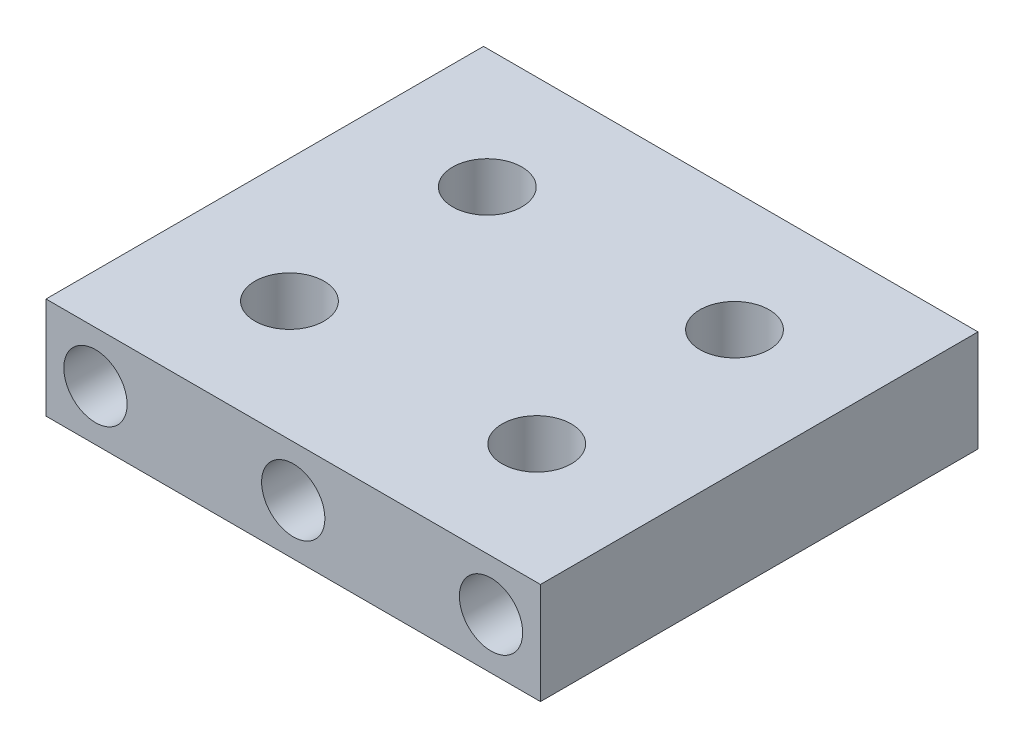
from build123d import *

# Parameters (mm, degrees)
SKETCH1_W           = 25
SKETCH1_H           = 22.12
SKETCH1_R           = 1.75
BOSS_EXTRUDE1_DEPTH = 5.13
CUT_EXTRUDE1_REACH  = 27.92
SKETCH2_R           = 1.6


with BuildPart() as part:
    # Sketch1 → Boss-Extrude1 (new body)
    with BuildSketch(Plane(origin=(0, 0, 0), x_dir=(1, 0, 0), z_dir=(0, 1, 0))):
        Rectangle(SKETCH1_W, SKETCH1_H)
        with Locations((-6.25, -5)):
            Circle(SKETCH1_R, mode=Mode.SUBTRACT)
        with Locations((6.25, -5)):
            Circle(SKETCH1_R, mode=Mode.SUBTRACT)
        with Locations((-6.25, 5)):
            Circle(SKETCH1_R, mode=Mode.SUBTRACT)
        with Locations((6.25, 5)):
            Circle(SKETCH1_R, mode=Mode.SUBTRACT)
    extrude(amount=BOSS_EXTRUDE1_DEPTH)

    # Sketch2 → Cut-Extrude1 (cut, up to next)
    with BuildSketch(Plane.XY.offset(11.06), mode=Mode.PRIVATE) as cut_extrude1_sk1:
        with Locations((0, 2.565)):
            Circle(SKETCH2_R)
    cut_extrude1_tool1 = extrude(cut_extrude1_sk1.sketch, amount=-CUT_EXTRUDE1_REACH, mode=Mode.PRIVATE) & part.part
    # Sketch2 → Cut-Extrude1 (cut, up to next)
    with BuildSketch(Plane.XY.offset(11.06), mode=Mode.PRIVATE) as cut_extrude1_sk2:
        with Locations((-10, 2.565)):
            Circle(SKETCH2_R)
    cut_extrude1_tool2 = extrude(cut_extrude1_sk2.sketch, amount=-CUT_EXTRUDE1_REACH, mode=Mode.PRIVATE) & part.part
    # Sketch2 → Cut-Extrude1 (cut, up to next)
    with BuildSketch(Plane.XY.offset(11.06), mode=Mode.PRIVATE) as cut_extrude1_sk3:
        with Locations((10, 2.565)):
            Circle(SKETCH2_R)
    cut_extrude1_tool3 = extrude(cut_extrude1_sk3.sketch, amount=-CUT_EXTRUDE1_REACH, mode=Mode.PRIVATE) & part.part
    add(cut_extrude1_tool1.solids().sort_by_distance((0, 2.565, 11.06))[0], mode=Mode.SUBTRACT)
    add(cut_extrude1_tool2.solids().sort_by_distance((-10, 2.565, 11.06))[0], mode=Mode.SUBTRACT)
    add(cut_extrude1_tool3.solids().sort_by_distance((10, 2.565, 11.06))[0], mode=Mode.SUBTRACT)


solid = part.part
